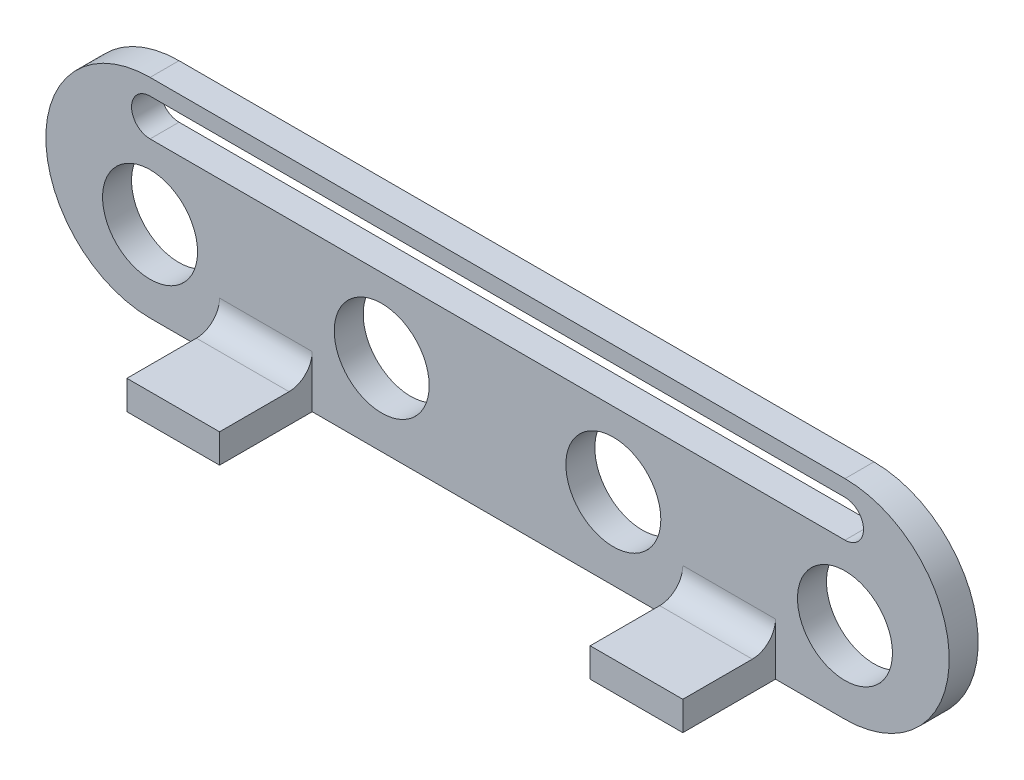
from build123d import *

# Parameters (mm, degrees)
SKETCH1_R           = 5.207
BOSS_EXTRUDE1_DEPTH = 3.175
SKETCH2_W           = 10.16
SKETCH2_H           = 3.175
BOSS_EXTRUDE2_DEPTH = 10.16
FILLET1_R           = 2.54
CUT_EXTRUDE2_REACH  = 53.837


with BuildPart() as part:
    # Sketch1 → Boss-Extrude1 (new body)
    with BuildSketch(Plane.XY):
        with BuildLine():
            Line((-38.1, 11.43), (38.1, 11.43))
            ThreePointArc((38.1, 11.43), (49.53, 0), (38.1, -11.43))
            Line((38.1, -11.43), (-38.1, -11.43))
            ThreePointArc((-38.1, -11.43), (-49.53, 0), (-38.1, 11.43))
        make_face()
        with Locations((-38.1, -2.54)):
            Circle(SKETCH1_R, mode=Mode.SUBTRACT)
        with Locations((-12.7, -2.54)):
            Circle(SKETCH1_R, mode=Mode.SUBTRACT)
        with Locations((12.7, -2.54)):
            Circle(SKETCH1_R, mode=Mode.SUBTRACT)
        with Locations((38.1, -2.54)):
            Circle(SKETCH1_R, mode=Mode.SUBTRACT)
    extrude(amount=BOSS_EXTRUDE1_DEPTH)

    # Sketch2 → Boss-Extrude2 (add)
    with BuildSketch(Plane.XY.offset(3.175)):
        with Locations((-25.4, -9.8425)):
            Rectangle(SKETCH2_W, SKETCH2_H)
        with Locations((25.4, -9.8425)):
            Rectangle(SKETCH2_W, SKETCH2_H)
    extrude(amount=BOSS_EXTRUDE2_DEPTH)

    # Fillet1
    fillet1_edges = [part.edges().sort_by_distance(p)[0] for p in [
        (25.4, -8.255, 3.175),
        (-25.4, -8.255, 3.175),
    ]]
    fillet(fillet1_edges, radius=FILLET1_R)

    # Sketch4 → Cut-Extrude2 (cut, up to next)
    with BuildSketch(Plane.XY.offset(3.175), mode=Mode.PRIVATE) as cut_extrude2_sk1:
        with BuildLine():
            Line((-38.1, 9.652), (38.1, 9.652))
            ThreePointArc((38.1, 9.652), (40.132, 7.62), (38.1, 5.588))
            Line((38.1, 5.588), (-38.1, 5.588))
            ThreePointArc((-38.1, 5.588), (-40.132, 7.62), (-38.1, 9.652))
        make_face()
    cut_extrude2_tool1 = extrude(cut_extrude2_sk1.sketch, amount=-CUT_EXTRUDE2_REACH, mode=Mode.PRIVATE) & part.part
    add(cut_extrude2_tool1.solids().sort_by_distance((0, 7.62, 3.175))[0], mode=Mode.SUBTRACT)


solid = part.part
